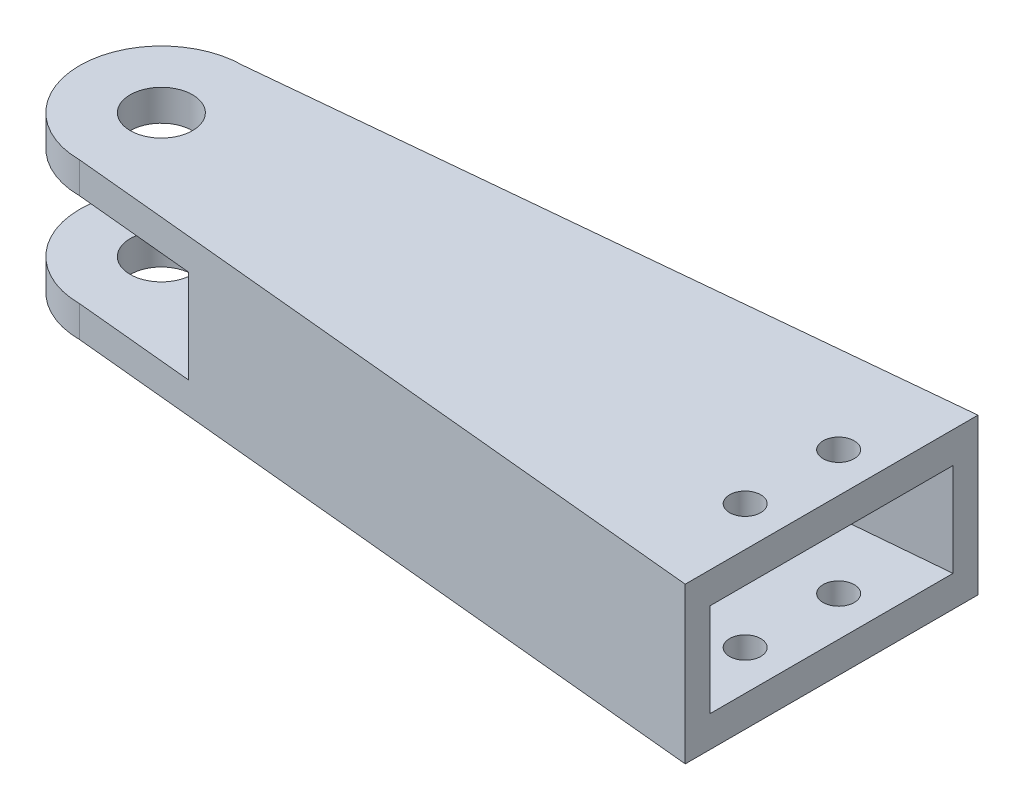
from build123d import *

# Parameters (mm, degrees)
SKETCH1_R               = 4
SKETCH1_R_2             = 2
BOSS_EXTRUDE1_DEPTH     = 10
SKETCH3_W               = 31.19
SKETCH3_H               = 12
CUT_EXTRUDE1_DEPTH      = 20
DRAFT1_ANGLE            = 5.03318731
CUT_EXTRUDE2_DEPTH      = 99.920109305
CUT_EXTRUDE2_DEPTH_BACK = 99.920109305
SKETCH4_W               = 26
SKETCH4_H               = 12


with BuildPart() as part:
    # Sketch1 → Boss-Extrude1 (new, symmetric)
    with BuildSketch(Plane(origin=(0, 0, 0), x_dir=(1, 0, 0), z_dir=(0, 1, 0))):
        with BuildLine():
            Line((0, 18.805), (0, -18.805))
            Line((0, -18.805), (-86.1, -10.5))
            ThreePointArc((-86.1, -10.5), (-96.6, 0), (-86.1, 10.5))
            Line((-86.1, 10.5), (0, 18.805))
        make_face()
        with Locations(Location((-86.1, 0, 0), (0, 0, 270))):
            Circle(SKETCH1_R, mode=Mode.SUBTRACT)
        with Locations(Location((-5.1, 6.005, 0), (0, 0, 270))):
            Circle(SKETCH1_R_2, mode=Mode.SUBTRACT)
        with Locations(Location((-5.1, -6.005, 0), (0, 0, 270))):
            Circle(SKETCH1_R_2, mode=Mode.SUBTRACT)
    extrude(amount=BOSS_EXTRUDE1_DEPTH, both=True)

    # Sketch3 → Cut-Extrude1 (cut)
    with BuildSketch(Plane(origin=(0, 0, 0), x_dir=(0, 0, -1), z_dir=(1, 0, 0))):
        Rectangle(SKETCH3_W, SKETCH3_H)
    extrude(amount=-CUT_EXTRUDE1_DEPTH, mode=Mode.SUBTRACT)

    # Draft1
    draft1_faces = [part.faces().sort_by_distance(p)[0] for p in [
        (-10, 0, 15.595),
        (-10, 0, -15.595),
    ]]
    draft(draft1_faces, Plane(origin=(0, 10, -18.805), x_dir=(0, 0, 1), z_dir=(1, 0, 0)), DRAFT1_ANGLE)

    # Sketch4 → Cut-Extrude2 (cut, two sides: drawn at the far end of the back side and taken through both)
    with BuildSketch(Plane.XY.offset(-CUT_EXTRUDE2_DEPTH_BACK)):
        with Locations((-83.6, 0)):
            Rectangle(SKETCH4_W, SKETCH4_H)
    extrude(amount=CUT_EXTRUDE2_DEPTH + CUT_EXTRUDE2_DEPTH_BACK, mode=Mode.SUBTRACT)


solid = part.part
